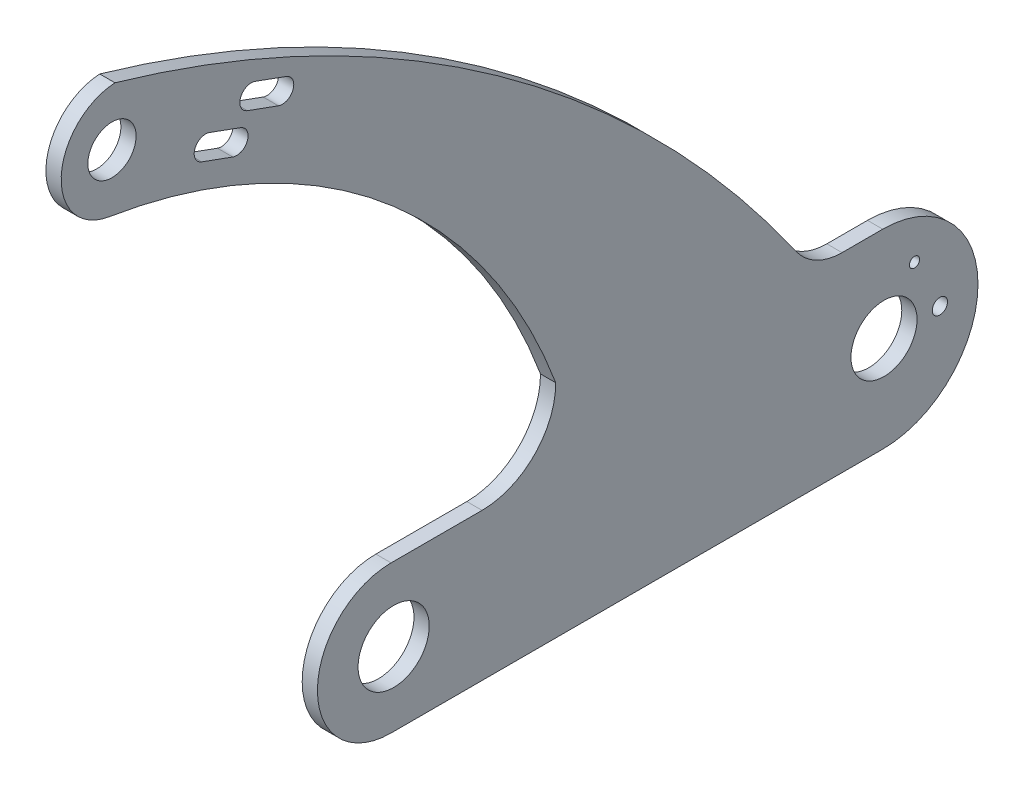
from build123d import *

# Parameters (mm, degrees)
SKETCH1_R               = 1.5
SKETCH1_R_2             = 1
SKETCH1_R_3             = 7
SKETCH1_R_4             = 4.75
BOSS_EXTRUDE1_DEPTH     = 3
CUT_EXTRUDE1_DEPTH      = 179.582042719
CUT_EXTRUDE1_DEPTH_BACK = 179.582042719
SKETCH2_R               = 6.5


with BuildPart() as part:
    # Sketch1 → Boss-Extrude1 (new body)
    with BuildSketch(Plane(origin=(0, 0, 0), x_dir=(0, 0, -1), z_dir=(1, 0, 0))):
        with BuildLine():
            Line((-48.375, 0), (48.375, 0))
            ThreePointArc((48.375, 0), (67.125, 18.75), (48.375, 37.5))
            Line((48.375, 37.5), (40.375, 37.5))
            ThreePointArc((40.375, 37.5), (35.295765254, 38.742880835), (31.364327513, 42.1906592))
            ThreePointArc((31.364327513, 42.1906592), (-27.467628368, 101.587088748), (-102.722095146, 138))
            ThreePointArc((-102.722095146, 138), (-113.291936406, 127.38864025), (-103.88918697, 115.730561375))
            ThreePointArc((-103.88918697, 115.730561375), (-50.193524878, 91.468412174), (-15.975, 43.5))
            ThreePointArc((-15.975, 43.5), (-20.221951673, 33.246951673), (-30.475, 29))
            Line((-30.475, 29), (-48.375, 29))
            ThreePointArc((-48.375, 29), (-62.875, 14.5), (-48.375, 0))
        make_face()
        with Locations((59.625, 18.75)):
            Circle(SKETCH1_R, mode=Mode.SUBTRACT)
        with Locations((54.625, 28.75)):
            Circle(SKETCH1_R_2, mode=Mode.SUBTRACT)
        with Locations((-47.875, 14.5)):
            Circle(SKETCH1_R_3, mode=Mode.SUBTRACT)
        with Locations((-103.305641058, 126.865280687)):
            Circle(SKETCH1_R_4, mode=Mode.SUBTRACT)
        with BuildLine():
            Line((46.625, 23.25), (48.625, 23.25))
            ThreePointArc((48.625, 23.25), (53.125, 18.75), (48.625, 14.25))
            Line((48.625, 14.25), (46.625, 14.25))
            ThreePointArc((46.625, 14.25), (42.125, 18.75), (46.625, 23.25))
        make_face(mode=Mode.SUBTRACT)
        with BuildLine():
            Line((-84.112179989, 120.210043762), (-78.004177954, 117.98691283))
            ThreePointArc((-78.004177954, 117.98691283), (-76.659414879, 115.103059111), (-79.543268599, 113.758296037))
            Line((-79.543268599, 113.758296037), (-85.651270634, 115.981426968))
            ThreePointArc((-85.651270634, 115.981426968), (-86.996033708, 118.865280687), (-84.112179989, 120.210043762))
        make_face(mode=Mode.SUBTRACT)
        with BuildLine():
            Line((-75.120324234, 124.438660555), (-69.012322199, 122.215529624))
            ThreePointArc((-69.012322199, 122.215529624), (-67.667559125, 119.331675904), (-70.551412844, 117.98691283))
            Line((-70.551412844, 117.98691283), (-76.659414879, 120.210043762))
            ThreePointArc((-76.659414879, 120.210043762), (-78.004177954, 123.093897481), (-75.120324234, 124.438660555))
        make_face(mode=Mode.SUBTRACT)
    extrude(amount=BOSS_EXTRUDE1_DEPTH)

    # Sketch2 → Cut-Extrude1 (cut, two sides: drawn at the far end of the back side and taken through both)
    with BuildSketch(Plane(origin=(3, 0, 0), x_dir=(0, 0, -1), z_dir=(1, 0, 0)).offset(-CUT_EXTRUDE1_DEPTH_BACK)):
        with Locations((48.625, 18.75)):
            Circle(SKETCH2_R)
    extrude(amount=CUT_EXTRUDE1_DEPTH + CUT_EXTRUDE1_DEPTH_BACK, mode=Mode.SUBTRACT)


solid = part.part
